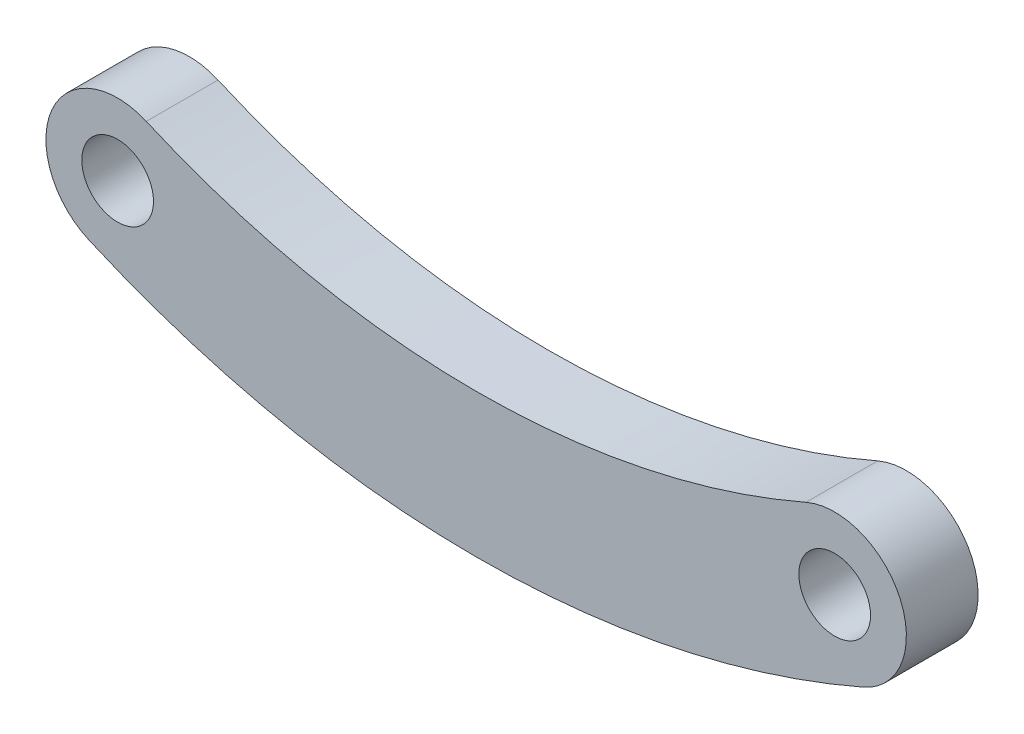
from build123d import *

# Parameters (mm, degrees)
SKETCH1_R           = 2
BOSS_EXTRUDE1_DEPTH = 4


with BuildPart() as part:
    # Sketch1 → Boss-Extrude1 (new body)
    with BuildSketch(Plane.XY):
        with BuildLine():
            ThreePointArc((-1.6, -3.666060556), (20, -8.17424305), (41.6, -3.666060556))
            ThreePointArc((41.6, -3.666060556), (43.666060556, 1.6), (38.4, 3.666060556))
            ThreePointArc((38.4, 3.666060556), (20, -0.17424305), (1.6, 3.666060556))
            ThreePointArc((1.6, 3.666060556), (-3.666060556, 1.6), (-1.6, -3.666060556))
        make_face()
        Circle(SKETCH1_R, mode=Mode.SUBTRACT)
        with Locations((40, 0)):
            Circle(SKETCH1_R, mode=Mode.SUBTRACT)
    extrude(amount=BOSS_EXTRUDE1_DEPTH)


solid = part.part
